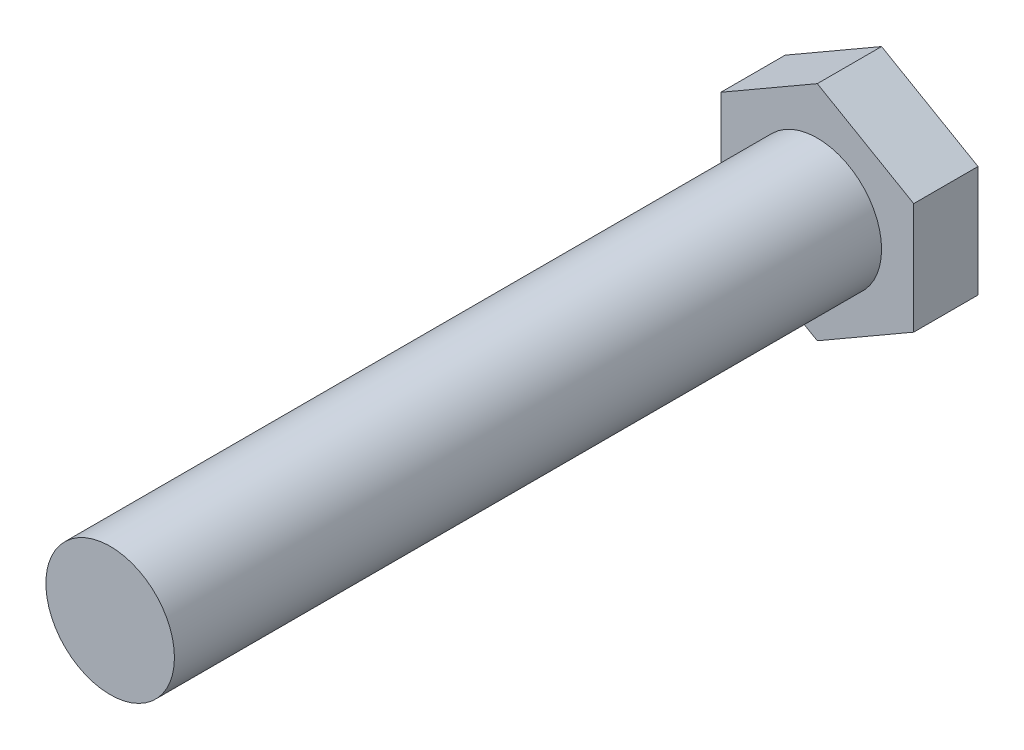
from build123d import *

# Parameters (mm, degrees)
BOSS_EXTRUDE1_DEPTH = 5
SKETCH2_R           = 5
BOSS_EXTRUDE2_DEPTH = 55


with BuildPart() as part:
    # Sketch1 → Boss-Extrude1 (new body)
    with BuildSketch(Plane.XY):
        Polygon((0, 8.660254038), (-7.5, 4.330127019), (-7.5, -4.330127019), (0, -8.660254038), (7.5, -4.330127019), (7.5, 4.330127019), align=None)
    extrude(amount=BOSS_EXTRUDE1_DEPTH)

    # Sketch2 → Boss-Extrude2 (add)
    with BuildSketch(Plane.XY.offset(5)):
        Circle(SKETCH2_R)
    extrude(amount=BOSS_EXTRUDE2_DEPTH)


solid = part.part
